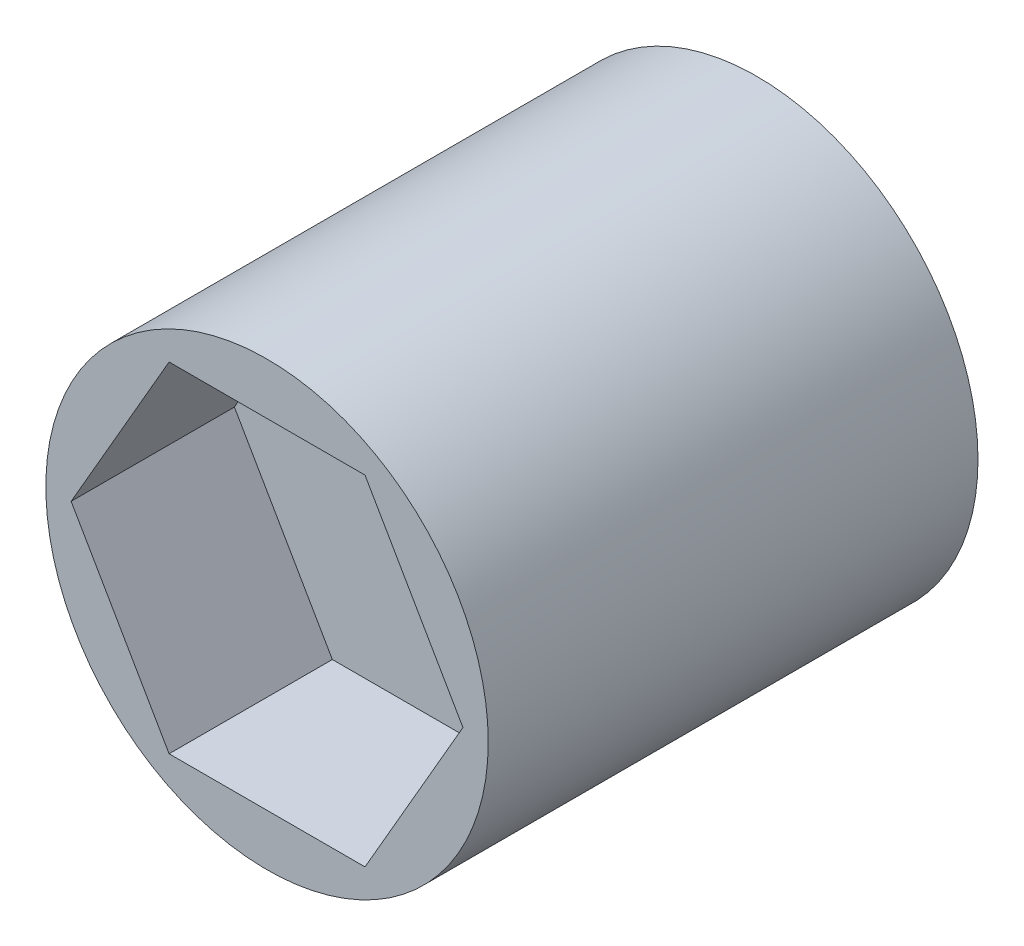
from build123d import *

# Parameters (mm, degrees)
SKETCH1_R           = 6.775
BOSS_EXTRUDE1_DEPTH = 15
CUT_EXTRUDE1_DEPTH  = 5


with BuildPart() as part:
    # Sketch1 → Boss-Extrude1 (new body)
    with BuildSketch(Plane.XY):
        Circle(SKETCH1_R)
    extrude(amount=BOSS_EXTRUDE1_DEPTH)

    # Sketch2 → Cut-Extrude1 (cut)
    with BuildSketch(Plane.XY.offset(15)):
        Polygon((-3, -5.196152423), (3, -5.196152423), (6, 0), (3, 5.196152423), (-3, 5.196152423), (-6, 0), align=None)
    extrude(amount=-CUT_EXTRUDE1_DEPTH, mode=Mode.SUBTRACT)


solid = part.part
